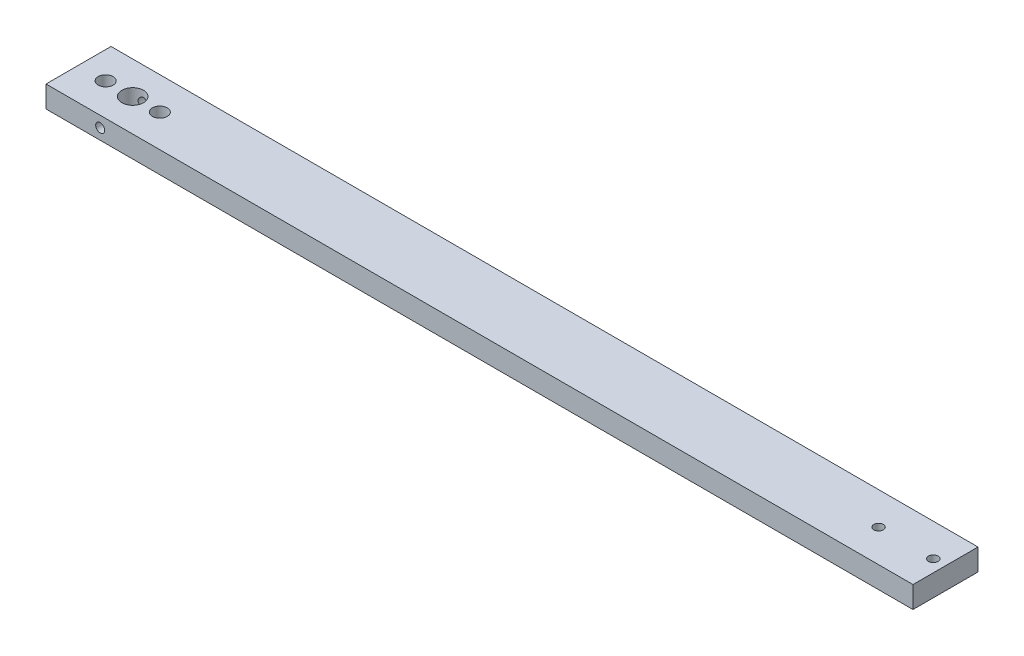
from build123d import *

# Parameters (mm, degrees)
BOSS_EXTRUDE1_DEPTH              = 4
BOSS_EXTRUDE1_DEPTH_BACK         = 4
SKETCH1_W                        = 320
SKETCH1_H                        = 24
SKETCH1_R                        = 2.75
SKETCH1_R_2                      = 1.75
SKETCH1_R_3                      = 4
TAP_DRILL_FOR_M4X0_7_TAP1_REACH  = 302.985
TAP_DRILL_FOR_M4X0_7_TAP1_BORE_R = 1.65
TAP_DRILL_FOR_M4X0_7_TAP2_D      = 3.3


with BuildPart() as part:
    # Sketch1 → Boss-Extrude1 (new, two sides: drawn at the far end of the back side and taken through both)
    with BuildSketch(Plane(origin=(0, 0, 0), x_dir=(1, 0, 0), z_dir=(0, 1, 0)).offset(-BOSS_EXTRUDE1_DEPTH_BACK)):
        with Locations((140, 0)):
            Rectangle(SKETCH1_W, SKETCH1_H)
        with Locations(Location((-10, 0, 0), (0, 0, 270))):
            Circle(SKETCH1_R, mode=Mode.SUBTRACT)
        with Locations(Location((10, 0, 0), (0, 0, 90))):
            Circle(SKETCH1_R, mode=Mode.SUBTRACT)
        with Locations(Location((295.5, 0, 0), (0, 0, 270))):
            Circle(SKETCH1_R_2, mode=Mode.SUBTRACT)
        with Locations(Location((275.3, 0, 0), (0, 0, 270))):
            Circle(SKETCH1_R_2, mode=Mode.SUBTRACT)
        with Locations(Location((0, 0, 0), (0, 0, 270))):
            Circle(SKETCH1_R_3, mode=Mode.SUBTRACT)
    extrude(amount=BOSS_EXTRUDE1_DEPTH + BOSS_EXTRUDE1_DEPTH_BACK)

    # Tap Drill for M4x0.7 Tap1 bore → Tap Drill for M4x0.7 Tap1 (cut, up to next)
    with BuildSketch(Plane.XY.offset(12), mode=Mode.PRIVATE) as tap_drill_for_m4x0_7_tap1_sk1:
        Circle(TAP_DRILL_FOR_M4X0_7_TAP1_BORE_R)
    tap_drill_for_m4x0_7_tap1_tool1 = extrude(tap_drill_for_m4x0_7_tap1_sk1.sketch, amount=-TAP_DRILL_FOR_M4X0_7_TAP1_REACH, mode=Mode.PRIVATE) & part.part
    add(tap_drill_for_m4x0_7_tap1_tool1.solids().sort_by_distance((0, 0, 12))[0], mode=Mode.SUBTRACT)

    # Tap Drill for M4x0.7 Tap2 (through all)
    with Locations(Plane(origin=(0, 0, -12), x_dir=(-1, 0, 0), z_dir=(0, 0, -1))):
        with Locations((0, 0)):
            Hole(TAP_DRILL_FOR_M4X0_7_TAP2_D / 2)


solid = part.part
